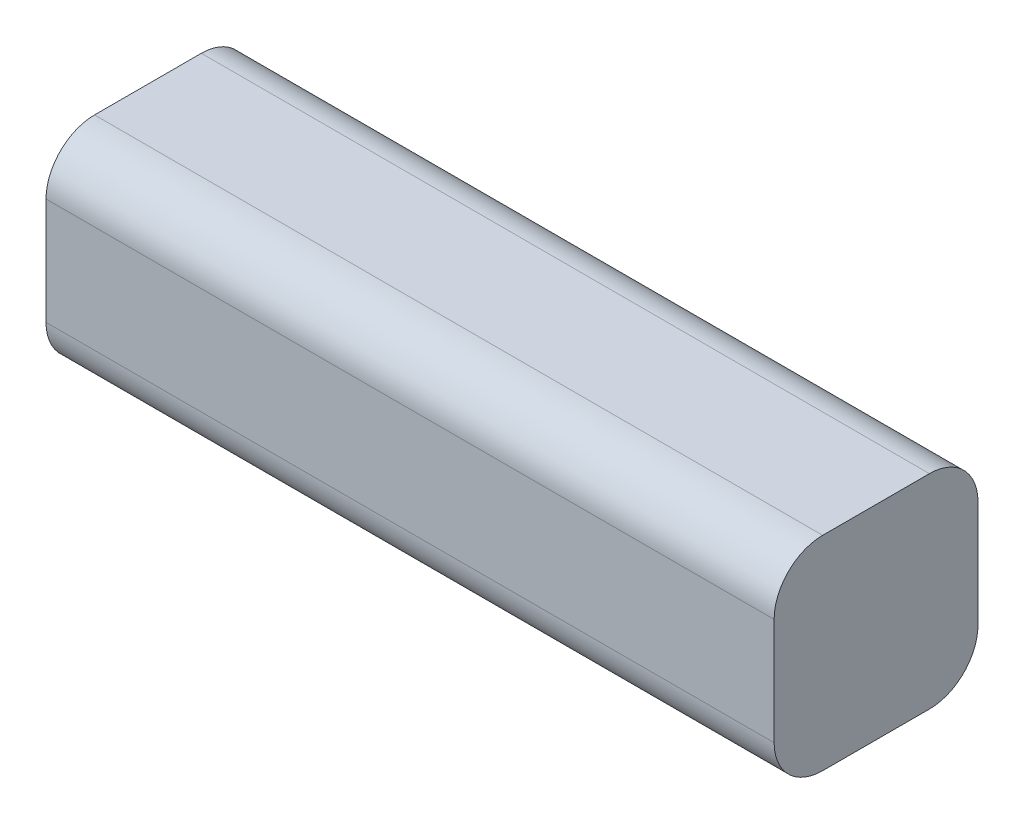
from build123d import *

# Parameters (mm, degrees)
SKETCH_1_W      = 150
SKETCH_1_H      = 42
EXTRUDE_1_DEPTH = 42
FILLET_1_R      = 10


with BuildPart() as part:
    # 草图1 → 凸台-拉伸1 (new body)
    with BuildSketch(Plane(origin=(0, 0, 0), x_dir=(1, 0, 0), z_dir=(0, 1, 0))):
        with Locations((75, 21)):
            Rectangle(SKETCH_1_W, SKETCH_1_H)
    extrude(amount=EXTRUDE_1_DEPTH)

    # 圆角1
    fillet_1_edges = [part.edges().sort_by_distance(p)[0] for p in [
        (75, 42, -42),
        (75, 0, -42),
        (75, 0, 0),
        (75, 42, 0),
    ]]
    fillet(fillet_1_edges, radius=FILLET_1_R)


solid = part.part
